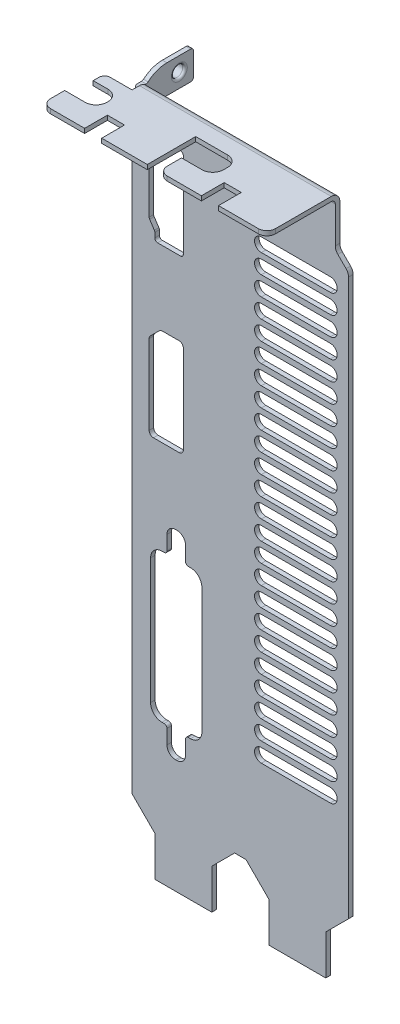
from build123d import *

# Parameters (mm, degrees)
BOSS_EXTRUDE1_DEPTH = 0.79375
CUT_EXTRUDE2_REACH  = 112.646
CUT_EXTRUDE3_REACH  = 112.646
LPATTERN1_COUNT     = 24
LPATTERN1_PITCH     = 3.375
BOSS_EXTRUDE5_DEPTH = 0.79375
FILLET4_R           = 1.5
FILLET5_R           = 0.725
SKETCH11_W          = 0.79375
SKETCH11_H          = 3.615911387
BOSS_EXTRUDE6_DEPTH = 2
SKETCH12_R          = 1
BOSS_EXTRUDE7_DEPTH = 0.79375
FILLET6_R           = 1
FILLET7_R           = 0.3
FILLET8_R           = 0.4
BOSS_EXTRUDE8_START = 1
SKETCH13_R          = 1.5
SKETCH13_R_2        = 1
BOSS_EXTRUDE8_DEPTH = 1


with BuildPart() as part:
    # Sketch1 → Boss-Extrude1 (new body)
    with BuildSketch(Plane.XY):
        with BuildLine():
            Line((-19, 101.378679656), (-19, 0))
            Line((-19, 0), (-15, -4))
            Line((-15, -4), (-15, -11))
            Line((-15, -11), (-5, -11))
            Line((-5, -11), (-5, -4))
            Line((-5, -4), (-1, 0))
            Line((-1, 0), (1, 0))
            Line((1, 0), (5, -4))
            Line((5, -4), (5, -11))
            Line((5, -11), (15, -11))
            Line((15, -11), (15, -4))
            Line((15, -4), (19, 0))
            Line((19, 0), (19, 97.552354868))
            ThreePointArc((19, 97.552354868), (18.885819299, 98.126380016), (18.560660172, 98.61301504))
            Line((18.560660172, 98.61301504), (17.11301504, 100.060660172))
            ThreePointArc((17.11301504, 100.060660172), (16.787855913, 100.547295195), (16.673675211, 101.121320344))
            Line((16.673675211, 101.121320344), (16.673675211, 109))
            Line((16.673675211, 109), (-17, 109))
            Line((-17, 109), (-17, 104.621320344))
            ThreePointArc((-17, 104.621320344), (-17.114180701, 104.047295195), (-17.439339828, 103.560660172))
            Line((-17.439339828, 103.560660172), (-18.560660172, 102.439339828))
            ThreePointArc((-18.560660172, 102.439339828), (-18.885819299, 101.952704805), (-19, 101.378679656))
        make_face()
    extrude(amount=BOSS_EXTRUDE1_DEPTH)

    # Sketch8 → Cut-Extrude2 (cut, up to next)
    with BuildSketch(Plane.XY.offset(0.79375), mode=Mode.PRIVATE) as cut_extrude2_sk1:
        with BuildLine():
            Line((-15.75, 37.5), (-15.75, 15.5))
            ThreePointArc((-15.75, 15.5), (-15.164213562, 14.085786438), (-13.75, 13.5))
            Line((-13.75, 13.5), (-13.375, 13.5))
            ThreePointArc((-13.375, 13.5), (-13.021446609, 13.353553391), (-12.875, 13))
            Line((-12.875, 13), (-12.875, 10.5))
            ThreePointArc((-12.875, 10.5), (-12.435660172, 9.439339828), (-11.375, 9))
            Line((-11.375, 9), (-11.125, 9))
            ThreePointArc((-11.125, 9), (-10.064339828, 9.439339828), (-9.625, 10.5))
            Line((-9.625, 10.5), (-9.625, 13))
            ThreePointArc((-9.625, 13), (-9.478553391, 13.353553391), (-9.125, 13.5))
            Line((-9.125, 13.5), (-8.75, 13.5))
            ThreePointArc((-8.75, 13.5), (-7.335786438, 14.085786438), (-6.75, 15.5))
            Line((-6.75, 15.5), (-6.75, 37.5))
            ThreePointArc((-6.75, 37.5), (-7.335786438, 38.914213562), (-8.75, 39.5))
            Line((-8.75, 39.5), (-9.125, 39.5))
            ThreePointArc((-9.125, 39.5), (-9.478553391, 39.646446609), (-9.625, 40))
            Line((-9.625, 40), (-9.625, 42.5))
            ThreePointArc((-9.625, 42.5), (-10.064339828, 43.560660172), (-11.125, 44))
            Line((-11.125, 44), (-11.375, 44))
            ThreePointArc((-11.375, 44), (-12.435660172, 43.560660172), (-12.875, 42.5))
            Line((-12.875, 42.5), (-12.875, 40))
            ThreePointArc((-12.875, 40), (-13.021446609, 39.646446609), (-13.375, 39.5))
            Line((-13.375, 39.5), (-13.75, 39.5))
            ThreePointArc((-13.75, 39.5), (-15.164213562, 38.914213562), (-15.75, 37.5))
        make_face()
    cut_extrude2_tool1 = extrude(cut_extrude2_sk1.sketch, amount=-CUT_EXTRUDE2_REACH, mode=Mode.PRIVATE) & part.part
    # Sketch8 → Cut-Extrude2 (cut, up to next)
    with BuildSketch(Plane.XY.offset(0.79375), mode=Mode.PRIVATE) as cut_extrude2_sk2:
        with BuildLine():
            Line((-14.219669914, 72.780330086), (-15.780330086, 71.219669914))
            ThreePointArc((-15.780330086, 71.219669914), (-15.942909649, 70.976352402), (-16, 70.689339828))
            Line((-16, 70.689339828), (-16, 56.75))
            ThreePointArc((-16, 56.75), (-15.780330086, 56.219669914), (-15.25, 56))
            Line((-15.25, 56), (-10.75, 56))
            ThreePointArc((-10.75, 56), (-10.219669914, 56.219669914), (-10, 56.75))
            Line((-10, 56.75), (-10, 72.25))
            ThreePointArc((-10, 72.25), (-10.219669914, 72.780330086), (-10.75, 73))
            Line((-10.75, 73), (-13.689339828, 73))
            ThreePointArc((-13.689339828, 73), (-13.976352402, 72.942909649), (-14.219669914, 72.780330086))
        make_face()
    cut_extrude2_tool2 = extrude(cut_extrude2_sk2.sketch, amount=-CUT_EXTRUDE2_REACH, mode=Mode.PRIVATE) & part.part
    # Sketch8 → Cut-Extrude2 (cut, up to next)
    with BuildSketch(Plane.XY.offset(0.79375), mode=Mode.PRIVATE) as cut_extrude2_sk3:
        with BuildLine():
            Line((-15.916025147, 88.874037721), (-15.083974853, 87.625962279))
            ThreePointArc((-15.083974853, 87.625962279), (-15.021453987, 87.493504255), (-15, 87.348612181))
            Line((-15, 87.348612181), (-15, 86.5))
            ThreePointArc((-15, 86.5), (-14.853553391, 86.146446609), (-14.5, 86))
            Line((-14.5, 86), (-10.5, 86))
            ThreePointArc((-10.5, 86), (-10.146446609, 86.146446609), (-10, 86.5))
            Line((-10, 86.5), (-10, 101.5))
            ThreePointArc((-10, 101.5), (-10.146446609, 101.853553391), (-10.5, 102))
            Line((-10.5, 102), (-14.5, 102))
            ThreePointArc((-14.5, 102), (-14.853553391, 101.853553391), (-15, 101.5))
            Line((-15, 101.5), (-15, 100.651387819))
            ThreePointArc((-15, 100.651387819), (-15.021453987, 100.506495745), (-15.083974853, 100.374037721))
            Line((-15.083974853, 100.374037721), (-15.916025147, 99.125962279))
            ThreePointArc((-15.916025147, 99.125962279), (-15.978546013, 98.993504255), (-16, 98.848612181))
            Line((-16, 98.848612181), (-16, 89.151387819))
            ThreePointArc((-16, 89.151387819), (-15.978546013, 89.006495745), (-15.916025147, 88.874037721))
        make_face()
    cut_extrude2_tool3 = extrude(cut_extrude2_sk3.sketch, amount=-CUT_EXTRUDE2_REACH, mode=Mode.PRIVATE) & part.part
    add(cut_extrude2_tool1.solids().sort_by_distance((-11.25, 26.5, 0.79375))[0], mode=Mode.SUBTRACT)
    add(cut_extrude2_tool2.solids().sort_by_distance((-12.956107, 64.351009, 0.79375))[0], mode=Mode.SUBTRACT)
    add(cut_extrude2_tool3.solids().sort_by_distance((-12.87515, 94, 0.79375))[0], mode=Mode.SUBTRACT)

    # Sketch9 → Cut-Extrude3 (cut, up to next)
    with BuildSketch(Plane.XY.offset(0.79375), mode=Mode.PRIVATE) as cut_extrude3_sk1:
        with BuildLine():
            Line((3.690625, 16), (15.809375, 16))
            ThreePointArc((15.809375, 16), (17, 17.190625), (15.809375, 18.38125))
            Line((15.809375, 18.38125), (3.690625, 18.38125))
            ThreePointArc((3.690625, 18.38125), (2.5, 17.190625), (3.690625, 16))
        make_face()
    cut_extrude3_tool1 = extrude(cut_extrude3_sk1.sketch, amount=-CUT_EXTRUDE3_REACH, mode=Mode.PRIVATE) & part.part
    cut_extrude3 = cut_extrude3_tool1.solids().sort_by_distance((9.75, 17.190625, 0.79375))[0]
    add(cut_extrude3, mode=Mode.SUBTRACT)

    # LPattern1: Cut-Extrude3 ×24
    with Locations(*[(0, i * LPATTERN1_PITCH, 0) for i in range(1, LPATTERN1_COUNT)]):
        add(cut_extrude3, mode=Mode.SUBTRACT)

    # Sketch10 → Boss-Extrude5 (add)
    with BuildSketch(Plane(origin=(0, 109, 0), x_dir=(1, 0, 0), z_dir=(0, 1, 0))):
        with BuildLine():
            Line((16.673675211, -0.79375), (16.673675211, -11.29375))
            ThreePointArc((16.673675211, -11.29375), (16.234335383, -12.354410172), (15.173675211, -12.79375))
            Line((15.173675211, -12.79375), (8.173675211, -12.79375))
            Line((8.173675211, -12.79375), (8.173675211, -8.79375))
            Line((8.173675211, -8.79375), (5.173675211, -8.79375))
            Line((5.173675211, -8.79375), (5.173675211, -12.79375))
            Line((5.173675211, -12.79375), (-0.826324789, -12.79375))
            ThreePointArc((-0.826324789, -12.79375), (-1.88698496, -12.354410172), (-2.326324789, -11.29375))
            Line((-2.326324789, -11.29375), (-2.326324789, -8.79375))
            Line((-2.326324789, -8.79375), (1.273675211, -8.79375))
            ThreePointArc((1.273675211, -8.79375), (2.617178096, -8.237252884), (3.173675211, -6.89375))
            Line((3.173675211, -6.89375), (3.173675211, -6.19375))
            ThreePointArc((3.173675211, -6.19375), (2.617178096, -4.850247116), (1.273675211, -4.29375))
            Line((1.273675211, -4.29375), (-4.326324789, -4.29375))
            Line((-4.326324789, -4.29375), (-4.326324789, -12.79375))
            Line((-4.326324789, -12.79375), (-12.326324789, -12.79375))
            Line((-12.326324789, -12.79375), (-12.326324789, -8.79375))
            Line((-12.326324789, -8.79375), (-15.326324789, -8.79375))
            Line((-15.326324789, -8.79375), (-15.326324789, -12.79375))
            Line((-15.326324789, -12.79375), (-21.326324789, -12.79375))
            ThreePointArc((-21.326324789, -12.79375), (-22.38698496, -12.354410172), (-22.826324789, -11.29375))
            Line((-22.826324789, -11.29375), (-22.826324789, -8.79375))
            Line((-22.826324789, -8.79375), (-19.226324789, -8.79375))
            ThreePointArc((-19.226324789, -8.79375), (-17.882821904, -8.237252884), (-17.326324789, -6.89375))
            Line((-17.326324789, -6.89375), (-17.326324789, -6.69375))
            ThreePointArc((-17.326324789, -6.69375), (-17.882821904, -5.350247116), (-19.226324789, -4.79375))
            Line((-19.226324789, -4.79375), (-21.826324789, -4.79375))
            Line((-21.826324789, -4.79375), (-21.826324789, -3.79375))
            ThreePointArc((-21.826324789, -3.79375), (-21.53343157, -3.086643219), (-20.826324789, -2.79375))
            Line((-20.826324789, -2.79375), (-17, -2.79375))
            Line((-17, -2.79375), (-17, -0.79375))
            Line((-17, -0.79375), (16.673675211, -0.79375))
        make_face()
    extrude(amount=-BOSS_EXTRUDE5_DEPTH)

    # Fillet4
    fillet4_edges = [part.edges().sort_by_distance(p)[0] for p in [
        (-0.163162394, 109, 0),
    ]]
    fillet(fillet4_edges, radius=FILLET4_R)

    # Fillet5
    fillet5_edges = [part.edges().sort_by_distance(p)[0] for p in [
        (-0.163162394, 108.20625, 0.79375),
    ]]
    fillet(fillet5_edges, radius=FILLET5_R)

    # Sketch11 → Boss-Extrude6 (add)
    with BuildSketch(Plane.ZY.offset(17)):
        with Locations((0.396875, 105.673294306)):
            Rectangle(SKETCH11_W, SKETCH11_H)
    extrude(amount=BOSS_EXTRUDE6_DEPTH)

    # Sketch12 → Boss-Extrude7 (add)
    with BuildSketch(Plane.ZY.offset(19)):
        with BuildLine():
            Line((-8.70625, 103.865338613), (0, 103.865338613))
            Line((0, 103.865338613), (0, 107.48125))
            Line((0, 107.48125), (-0.859072875, 107.48125))
            ThreePointArc((-0.859072875, 107.48125), (-1.050414591, 107.519310234), (-1.212626266, 107.627696609))
            Line((-1.212626266, 107.627696609), (-0.985802176, 107.400872519))
            ThreePointArc((-0.985802176, 107.400872519), (-2.60791892, 108.484736276), (-4.521336082, 108.865338613))
            Line((-4.521336082, 108.865338613), (-8.70625, 108.865338613))
            ThreePointArc((-8.70625, 108.865338613), (-9.059803391, 108.718892004), (-9.20625, 108.365338613))
            Line((-9.20625, 108.365338613), (-9.20625, 104.365338613))
            ThreePointArc((-9.20625, 104.365338613), (-9.059803391, 104.011785223), (-8.70625, 103.865338613))
        make_face()
        with Locations(Location((-6.70625, 106.365338613, 0), (0, 0, 270))):
            Circle(SKETCH12_R, mode=Mode.SUBTRACT)
    extrude(amount=-BOSS_EXTRUDE7_DEPTH)

    # Fillet6
    fillet6_edges = [part.edges().sort_by_distance(p)[0] for p in [
        (-19, 105.673294307, 0.79375),
    ]]
    fillet(fillet6_edges, radius=FILLET6_R)

    # Fillet7
    fillet7_edges = [part.edges().sort_by_distance(p)[0] for p in [
        (-18.20625, 105.673294307, 0),
    ]]
    fillet(fillet7_edges, radius=FILLET7_R)

    # Fillet8
    fillet8_edges = [part.edges().sort_by_distance(p)[0] for p in [
        (-18.20625, 107.365338613, -6.70625),
    ]]
    fillet(fillet8_edges, radius=FILLET8_R)

    # Sketch13 → Boss-Extrude8 (add)
    with BuildSketch(Plane.ZY.offset(19).offset(BOSS_EXTRUDE8_START)):
        with Locations(Location((-6.70625, 106.365338613, 0), (0, 0, 90))):
            Circle(SKETCH13_R)
        with Locations(Location((-6.70625, 106.365338613, 0), (0, 0, 270))):
            Circle(SKETCH13_R_2, mode=Mode.SUBTRACT)
    extrude(amount=-BOSS_EXTRUDE8_DEPTH)


solid = part.part
